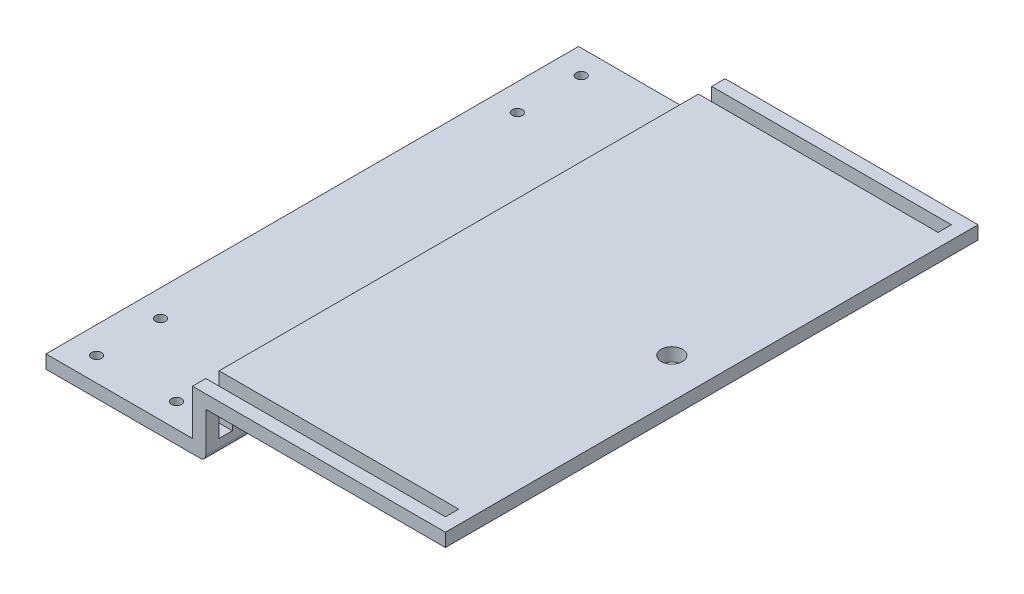
from build123d import *

# Parameters (mm, degrees)
SKETCH1_W           = 150
SKETCH1_H           = 200
BOSS_EXTRUDE1_DEPTH = 100
SHELL2_T            = -5
SKETCH5_R           = 1.9
CUT_EXTRUDE2_DEPTH  = 10
BOSS_EXTRUDE4_DEPTH = 200
SKETCH9_W           = 101.133931545
SKETCH9_H           = 31.996148617
CUT_EXTRUDE4_DEPTH  = 236.849528301
SKETCH10_R          = 4
CUT_EXTRUDE5_DEPTH  = 10
CUT_EXTRUDE7_REACH  = 162.078
SKETCH11_W          = 140
SKETCH11_H          = 5
SKETCH15_R          = 1.2
CUT_EXTRUDE11_DEPTH = 10
SKETCH36_W          = 60
SKETCH36_H          = 5
BOSS_EXTRUDE7_DEPTH = 10
SKETCH37_R          = 3.5
CUT_EXTRUDE15_DEPTH = 60
SKETCH38_R          = 5
CUT_EXTRUDE16_DEPTH = 70
SKETCH40_W          = 179.165652401
SKETCH40_H          = 85.135231114
SKETCH40_W_2        = 87.941982163
SKETCH40_H_2        = 17
CUT_EXTRUDE18_DEPTH = 236.849528301
FILLET1_R           = 2


with BuildPart() as part:
    # Sketch1 → Boss-Extrude1 (new body)
    with BuildSketch(Plane(origin=(0, 0, 0), x_dir=(1, 0, 0), z_dir=(0, 1, 0))):
        Rectangle(SKETCH1_W, SKETCH1_H)
    extrude(amount=BOSS_EXTRUDE1_DEPTH)

    # Shell2
    shell2_openings = [part.faces().sort_by_distance(p)[0] for p in [
        (0, 50, -100),
        (0, 50, 100),
    ]]
    offset(amount=SHELL2_T, openings=shell2_openings, kind=Kind.INTERSECTION)

    # Sketch5 → Cut-Extrude2 (cut)
    with BuildSketch(Plane.XZ):
        with Locations(Location((-65, 91, 0), (0, 0, 270))):
            Circle(SKETCH5_R)
        with Locations(Location((-35, 91, 0), (0, 0, 270))):
            Circle(SKETCH5_R)
        with Locations(Location((-65, 67, 0), (0, 0, 270))):
            Circle(SKETCH5_R)
        with Locations(Location((-35, 67, 0), (0, 0, 270))):
            Circle(SKETCH5_R)
    cut_extrude2 = extrude(amount=-CUT_EXTRUDE2_DEPTH, mode=Mode.SUBTRACT)

    # Mirror2: Cut-Extrude2 across plane
    add(cut_extrude2.mirror(Plane.XY), mode=Mode.SUBTRACT)

    # Sketch8 → Boss-Extrude4 (add, through all)
    with BuildSketch(Plane.XY.offset(100)):
        Polygon((-15, 17), (75, 17), (75, 22), (-20, 22), (-20, 0), (-15, 0), align=None)
    extrude(amount=-BOSS_EXTRUDE4_DEPTH)

    # Sketch9 → Cut-Extrude4 (cut, through all)
    with BuildSketch(Plane.XY.offset(100)):
        with Locations((35.566965773, 1.001925691)):
            Rectangle(SKETCH9_W, SKETCH9_H)
    extrude(amount=-CUT_EXTRUDE4_DEPTH, mode=Mode.SUBTRACT)

    # Sketch10 → Cut-Extrude5 (cut)
    with BuildSketch(Plane.XZ.offset(-17)):
        with Locations((60, 0)):
            Circle(SKETCH10_R)
    extrude(amount=-CUT_EXTRUDE5_DEPTH, mode=Mode.SUBTRACT)

    # Cut-Extrude7: up to this face of the body (flat: up to its plane)
    cut_extrude7_end = Plane(part.part.faces().sort_by_distance((-44.954220044, 5, 0))[0])
    # Sketch11 → Cut-Extrude7 (cut, up to the picked face)
    with BuildSketch(Plane(origin=(0, 100, 0), x_dir=(1, 0, 0), z_dir=(0, 1, 0)), mode=Mode.PRIVATE) as cut_extrude7_sk1:
        with Locations((0, -92.5)):
            Rectangle(SKETCH11_W, SKETCH11_H)
    cut_extrude7_tool1 = split(extrude(cut_extrude7_sk1.sketch, amount=-CUT_EXTRUDE7_REACH, mode=Mode.PRIVATE), bisect_by=cut_extrude7_end, keep=Keep.BOTH, mode=Mode.PRIVATE)
    cut_extrude7 = cut_extrude7_tool1.solids().sort_by(Axis((0, 100, 92.5), (0, -1, 0)))[0]
    add(cut_extrude7, mode=Mode.SUBTRACT)

    # Mirror3: Cut-Extrude7 across plane
    add(cut_extrude7.mirror(Plane.XY), mode=Mode.SUBTRACT)

    # Sketch15 → Cut-Extrude11 (cut)
    with BuildSketch(Plane(origin=(0, 100, 0), x_dir=(1, 0, 0), z_dir=(0, 1, 0))):
        with Locations(Location((50, 28, 0), (0, 0, 270))):
            Circle(SKETCH15_R)
        with Locations(Location((50, -28, 0), (0, 0, 270))):
            Circle(SKETCH15_R)
        with Locations(Location((-20, 20, 0), (0, 0, 270))):
            Circle(SKETCH15_R)
        with Locations(Location((-20, -20, 0), (0, 0, 270))):
            Circle(SKETCH15_R)
    extrude(amount=-CUT_EXTRUDE11_DEPTH, mode=Mode.SUBTRACT)

    # Sketch36 → Boss-Extrude7 (add)
    with BuildSketch(Plane.ZY.offset(-70)):
        with Locations((-13.202053215, 62.5)):
            Rectangle(SKETCH36_W, SKETCH36_H)
    boss_extrude7 = extrude(amount=BOSS_EXTRUDE7_DEPTH)

    # Mirror5: Boss-Extrude7 across plane
    add(boss_extrude7.mirror(Plane(origin=(0, 0, 0), x_dir=(0, 0, 1), z_dir=(1, 0, 0))))

    # Sketch37 → Cut-Extrude15 (cut)
    with BuildSketch(Plane(origin=(75, 0, 0), x_dir=(0, 0, -1), z_dir=(1, 0, 0))):
        with Locations((0, 75)):
            Circle(SKETCH37_R)
    extrude(amount=-CUT_EXTRUDE15_DEPTH, mode=Mode.SUBTRACT)

    # Sketch38 → Cut-Extrude16 (cut)
    with BuildSketch(Plane.ZY.offset(75)):
        with Locations((0, 80)):
            Circle(SKETCH38_R)
    extrude(amount=-CUT_EXTRUDE16_DEPTH, mode=Mode.SUBTRACT)

    # Sketch40 → Cut-Extrude18 (cut, through all)
    with BuildSketch(Plane.XY.offset(100)):
        with Locations((-9.51631739, 64.567615557)):
            Rectangle(SKETCH40_W, SKETCH40_H)
        with Locations((-63.970991082, 13.5)):
            Rectangle(SKETCH40_W_2, SKETCH40_H_2)
    extrude(amount=-CUT_EXTRUDE18_DEPTH, mode=Mode.SUBTRACT)

    # Fillet1
    fillet1_edges = [part.edges().sort_by_distance(p)[0] for p in [
        (-15, 0, 0),
        (-20, 5, 0),
        (-15, 17, 0),
    ]]
    fillet(fillet1_edges, radius=FILLET1_R)


solid = part.part
